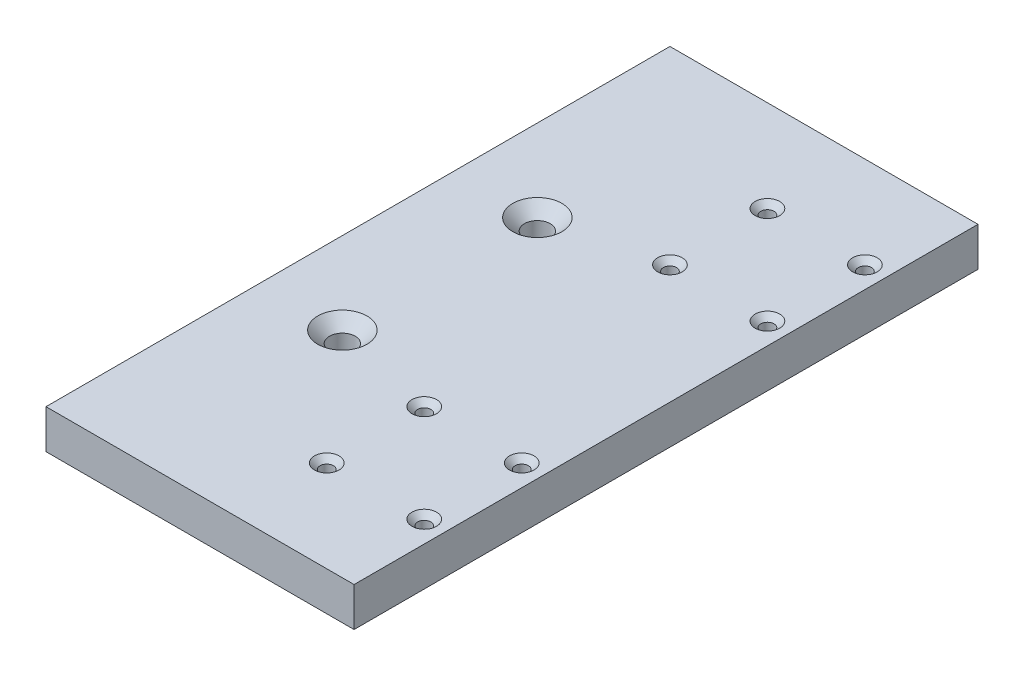
from build123d import *

# Parameters (mm, degrees)
SKETCH_1_W                  = 79
SKETCH_1_H                  = 160
EXTRUDE_300_DEPTH           = 10
HOLE_WIZARD_M3_D            = 3.4
HOLE_WIZARD_M3_CSINK_D      = 6.3
HOLE_WIZARD_M3_CSINK_ANGLE  = 90
HOLE_WIZARD_M6_D            = 6.6
HOLE_WIZARD_M6_CSINK_D      = 12.6
HOLE_WIZARD_M6_CSINK_ANGLE  = 90
HOLE_WIZARD_M61_D           = 5
HOLE_WIZARD_M61_DEPTH       = 35
HOLE_WIZARD_M61_CSINK_D     = 6.05
HOLE_WIZARD_M61_CSINK_ANGLE = 90
HOLE_WIZARD_M61_TIP         = 1.502151548


with BuildPart() as part:
    # Эскиз1 → Extrude 300 (new body)
    with BuildSketch(Plane(origin=(0, 0, 0), x_dir=(1, 0, 0), z_dir=(0, 1, 0))):
        Rectangle(SKETCH_1_W, SKETCH_1_H)
    extrude(amount=EXTRUDE_300_DEPTH)

    # Каретки M3 (through all)
    with Locations(Plane(origin=(0, 10, 0), x_dir=(1, 0, 0), z_dir=(0, 1, 0))):
        with Locations((9, -56.5), (34, -56.5), (34, -31.5), (9, -31.5), (9, 56.5), (9, 31.5), (34, 31.5), (34, 56.5)):
            CounterSinkHole(HOLE_WIZARD_M3_D / 2, HOLE_WIZARD_M3_CSINK_D / 2, counter_sink_angle=HOLE_WIZARD_M3_CSINK_ANGLE)

    # КреплениеПлиты-M6 (through all)
    with Locations(Plane(origin=(0, 10, 0), x_dir=(1, 0, 0), z_dir=(0, 1, 0))):
        with Locations((-18.5, 25), (-18.5, -25)):
            CounterSinkHole(HOLE_WIZARD_M6_D / 2, HOLE_WIZARD_M6_CSINK_D / 2, counter_sink_angle=HOLE_WIZARD_M6_CSINK_ANGLE)

    # Отверстие обработанное метчиком M61
    with Locations(Plane.ZY.offset(39.5)):
        with Locations((-40, 5), (40, 5)):
            CounterSinkHole(HOLE_WIZARD_M61_D / 2, HOLE_WIZARD_M61_CSINK_D / 2, depth=HOLE_WIZARD_M61_DEPTH, counter_sink_angle=HOLE_WIZARD_M61_CSINK_ANGLE)
            with Locations((0, 0, -(HOLE_WIZARD_M61_DEPTH + HOLE_WIZARD_M61_TIP / 2))):  # 118° drill point
                Cone(0, HOLE_WIZARD_M61_D / 2, HOLE_WIZARD_M61_TIP, mode=Mode.SUBTRACT)


solid = part.part
